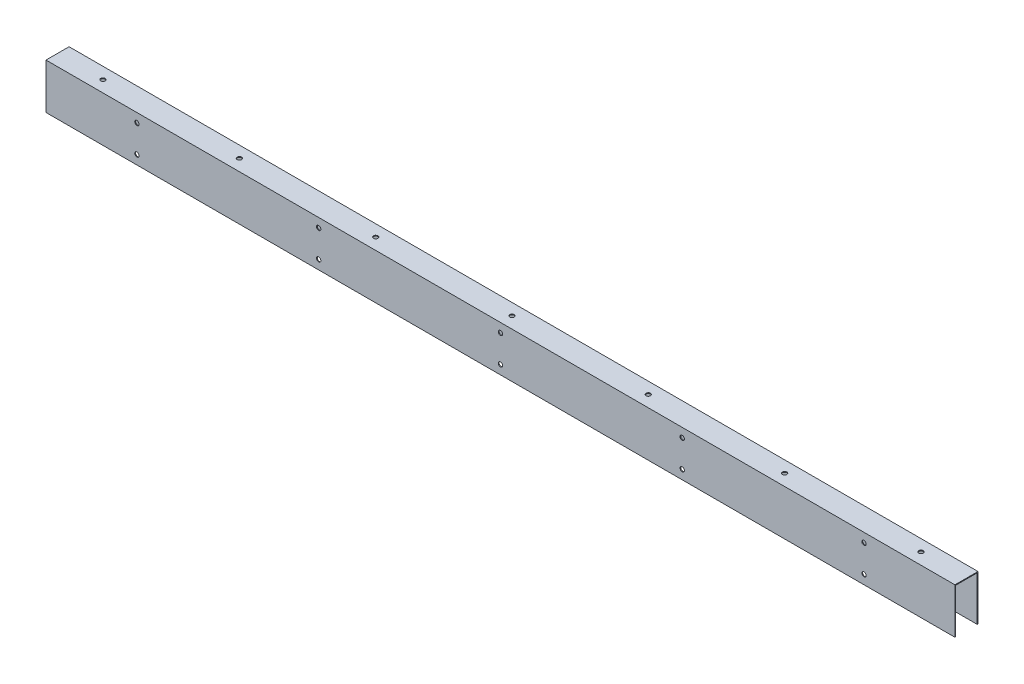
from build123d import *

# Parameters (mm, degrees)
BOSS_EXTRUDE1_DEPTH      = 25
BOSS_EXTRUDE1_DEPTH_BACK = 25
SKETCH2_W                = 1000
SKETCH2_H                = 25.4
CUT_EXTRUDE1_DEPTH       = 762
CUT_EXTRUDE1_DEPTH_BACK  = 762
SKETCH4_W                = 23.68
SKETCH4_H                = 49.713198884
SKETCH5_R                = 2.45
CUT_EXTRUDE2_DEPTH       = 39.05
CUT_EXTRUDE3_DEPTH       = 39.05
CUT_EXTRUDE3_DEPTH_BACK  = 39.05
SKETCH6_R                = 2.4


with BuildPart() as part:
    # Sketch2 → Boss-Extrude1 (new, two sides: drawn at the far end of the back side and taken through both)
    with BuildSketch(Plane(origin=(0, 0, 0), x_dir=(1, 0, 0), z_dir=(0, 1, 0)).offset(-BOSS_EXTRUDE1_DEPTH_BACK)):
        Rectangle(SKETCH2_W, SKETCH2_H)
    extrude(amount=BOSS_EXTRUDE1_DEPTH + BOSS_EXTRUDE1_DEPTH_BACK)

    # Sketch4 → Cut-Extrude1 (cut, two sides: drawn at the far end of the back side and taken through both)
    with BuildSketch(Plane(origin=(0, 0, 0), x_dir=(0, 0, -1), z_dir=(1, 0, 0)).offset(-CUT_EXTRUDE1_DEPTH_BACK)):
        with Locations((0, -0.716599442)):
            Rectangle(SKETCH4_W, SKETCH4_H)
    extrude(amount=CUT_EXTRUDE1_DEPTH + CUT_EXTRUDE1_DEPTH_BACK, mode=Mode.SUBTRACT)

    # Sketch5 → Cut-Extrude2 (cut)
    with BuildSketch(Plane(origin=(0, 0, 0), x_dir=(1, 0, 0), z_dir=(0, 1, 0))):
        Circle(SKETCH5_R)
        with Locations((150, 0)):
            Circle(SKETCH5_R)
        with Locations((300, 0)):
            Circle(SKETCH5_R)
        with Locations((450, 0)):
            Circle(SKETCH5_R)
        with Locations((-150, 0)):
            Circle(SKETCH5_R)
        with Locations((-300, 0)):
            Circle(SKETCH5_R)
        with Locations((-450, 0)):
            Circle(SKETCH5_R)
    extrude(amount=CUT_EXTRUDE2_DEPTH, mode=Mode.SUBTRACT)

    # Sketch6 → Cut-Extrude3 (cut, two sides: drawn at the far end of the back side and taken through both)
    with BuildSketch(Plane.XY.offset(-CUT_EXTRUDE3_DEPTH_BACK)):
        with Locations((0, 15)):
            Circle(SKETCH6_R)
        with Locations((0, -15)):
            Circle(SKETCH6_R)
        with Locations((200, 15)):
            Circle(SKETCH6_R)
        with Locations((200, -15)):
            Circle(SKETCH6_R)
        with Locations((400, 15)):
            Circle(SKETCH6_R)
        with Locations((400, -15)):
            Circle(SKETCH6_R)
        with Locations((600, 15)):
            Circle(SKETCH6_R)
        with Locations((600, -15)):
            Circle(SKETCH6_R)
        with Locations((-200, 15)):
            Circle(SKETCH6_R)
        with Locations((-200, -15)):
            Circle(SKETCH6_R)
        with Locations((-400, 15)):
            Circle(SKETCH6_R)
        with Locations((-400, -15)):
            Circle(SKETCH6_R)
        with Locations((-600, 15)):
            Circle(SKETCH6_R)
        with Locations((-600, -15)):
            Circle(SKETCH6_R)
    extrude(amount=CUT_EXTRUDE3_DEPTH + CUT_EXTRUDE3_DEPTH_BACK, mode=Mode.SUBTRACT)


solid = part.part
